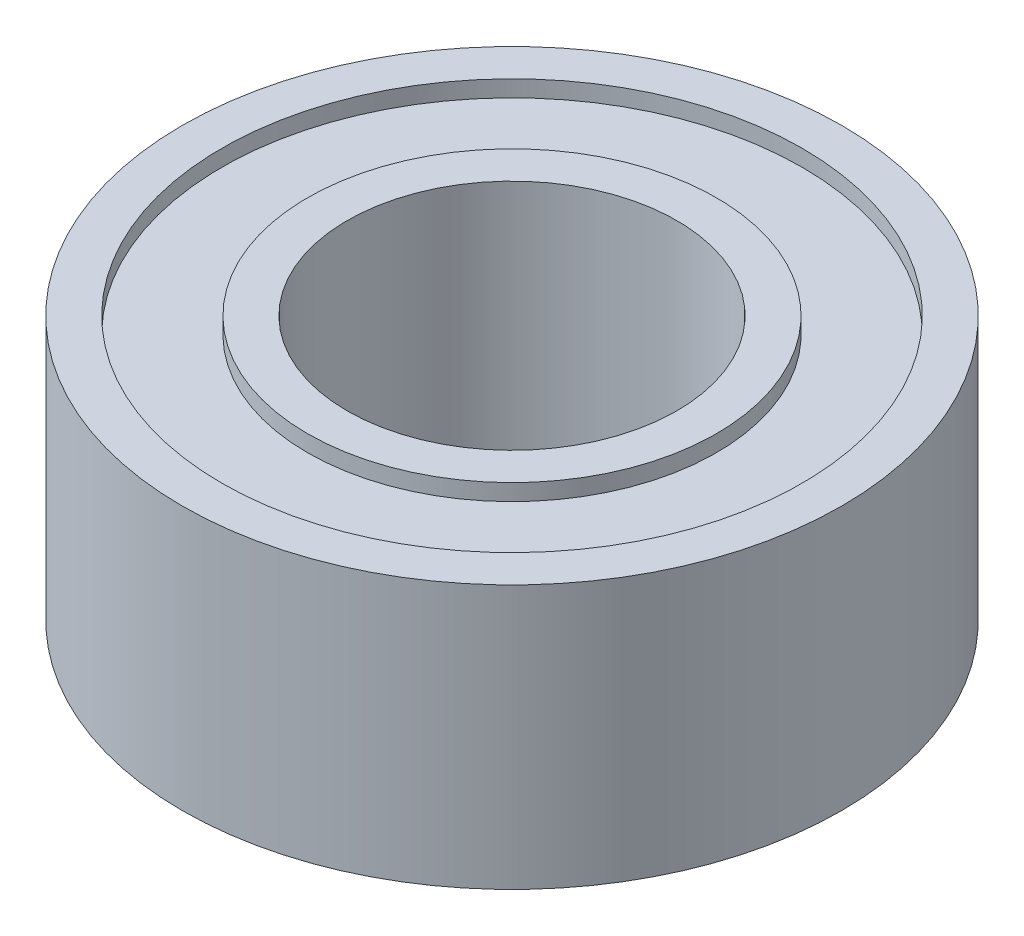
from build123d import *

# Parameters (mm, degrees)
SKETCH1_R           = 5
SKETCH1_R_2         = 2.5
BOSS_EXTRUDE1_DEPTH = 2
SKETCH2_R           = 4.4
SKETCH2_R_2         = 3.1
CUT_EXTRUDE1_DEPTH  = 0.25


with BuildPart() as part:
    # Sketch1 → Boss-Extrude1 (new, symmetric)
    with BuildSketch(Plane(origin=(0, 0, 0), x_dir=(1, 0, 0), z_dir=(0, 1, 0))):
        with Locations(Location((0, 0, 0), (0, 0, 270))):
            Circle(SKETCH1_R)
        with Locations(Location((0, 0, 0), (0, 0, 270))):
            Circle(SKETCH1_R_2, mode=Mode.SUBTRACT)
    extrude(amount=BOSS_EXTRUDE1_DEPTH, both=True)

    # Sketch2 → Cut-Extrude1 (cut)
    with BuildSketch(Plane(origin=(0, 2, 0), x_dir=(1, 0, 0), z_dir=(0, 1, 0))):
        with Locations(Location((0, 0, 0), (0, 0, 270))):
            Circle(SKETCH2_R)
        with Locations(Location((0, 0, 0), (0, 0, 270))):
            Circle(SKETCH2_R_2, mode=Mode.SUBTRACT)
    cut_extrude1 = extrude(amount=-CUT_EXTRUDE1_DEPTH, mode=Mode.SUBTRACT)

    # Mirror1: Cut-Extrude1 across plane
    add(cut_extrude1.mirror(Plane.ZX), mode=Mode.SUBTRACT)


solid = part.part
